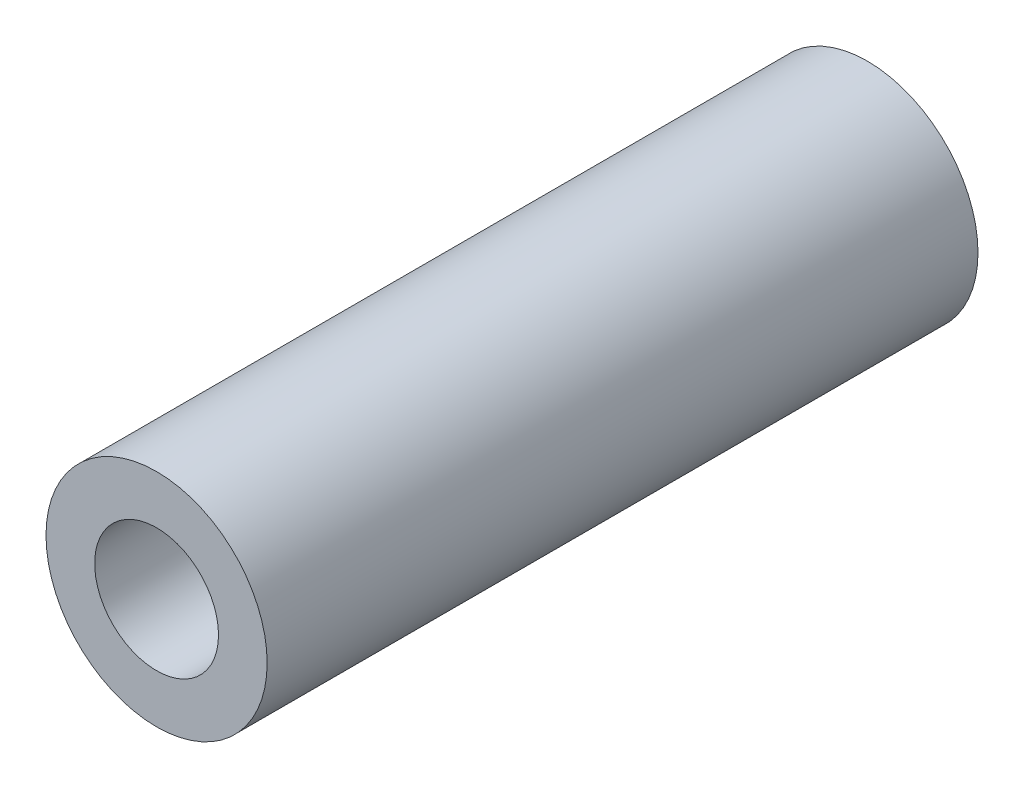
from build123d import *

# Parameters (mm, degrees)
SKETCH1_W = 28.575
SKETCH1_H = 1.9558


with BuildPart() as part:
    # Sketch1 → Revolve1 (revolve)
    with BuildSketch(Plane(origin=(0, 0, 0), x_dir=(0, 0, -1), z_dir=(1, 0, 0)), mode=Mode.PRIVATE) as revolve1_sk:
        with Locations((0, 3.4671)):
            Rectangle(SKETCH1_W, SKETCH1_H)
    revolve(revolve1_sk.sketch.rotate(Axis((0, 0, 43.465184419), (0, 0, -1)), 90), axis=Axis((0, 0, 43.465184419), (0, 0, -1)))


solid = part.part
